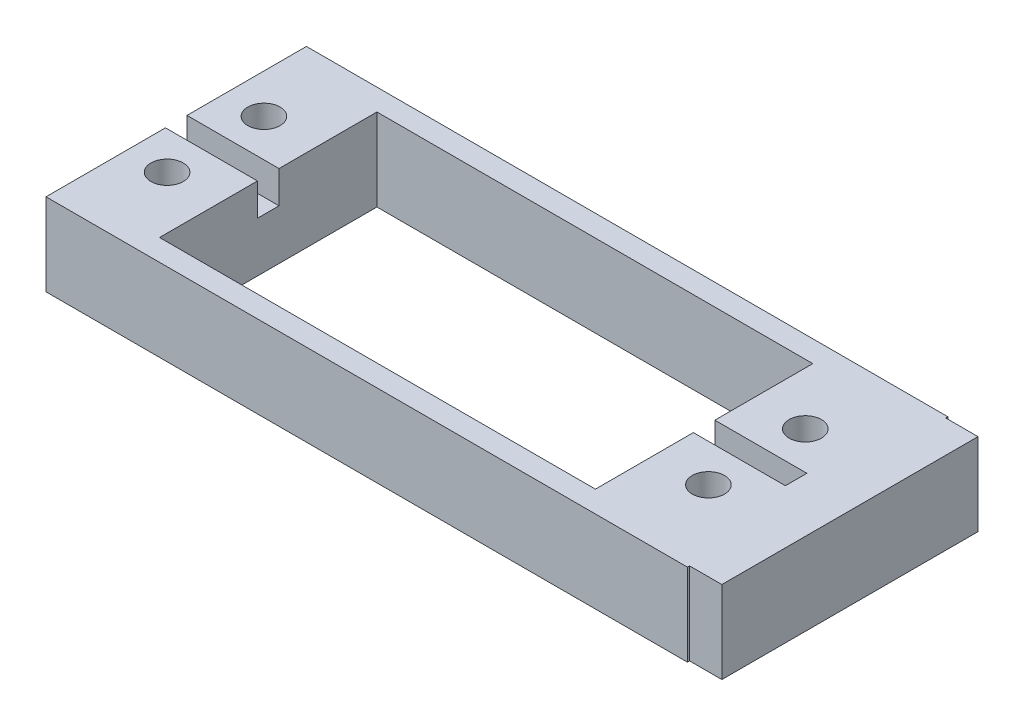
from build123d import *

# Parameters (mm, degrees)
SKETCH1_R             = 1.5
BOSS_EXTRUDE1_DEPTH   = 7.8
BOSS_EXTRUDE1_2_DEPTH = 7.8
SKETCH2_W             = 2
SKETCH2_H             = 20
BOSS_EXTRUDE2_DEPTH   = 7.8
SKETCH3_W             = 8.55
SKETCH3_H             = 0.1
BOSS_EXTRUDE3_DEPTH   = 7.8
SKETCH4_W             = 57.6
SKETCH4_H             = 2
BOSS_EXTRUDE4_DEPTH   = 7.8
SKETCH5_W             = 8.55
SKETCH5_H             = 2
CUT_EXTRUDE1_DEPTH    = 3
SKETCH6_R             = 1.5
BOSS_EXTRUDE5_DEPTH   = 7.8
SKETCH7_R             = 1.5
CUT_EXTRUDE2_DEPTH    = 4
SKETCH8_W             = 24.2
SKETCH8_H             = 7.8
BOSS_EXTRUDE6_DEPTH   = 5
SKETCH10_R            = 1.5
CUT_EXTRUDE3_DEPTH    = 110.980951326
SKETCH14_W            = 3
SKETCH14_H            = 0.2
CUT_EXTRUDE5_DEPTH    = 13.8
CUT_EXTRUDE6_DEPTH    = 0.15


with BuildPart() as part:
    # Sketch1 → Boss-Extrude1 (new body)
    with BuildSketch(Plane(origin=(0, 0, 0), x_dir=(1, 0, 0), z_dir=(0, 1, 0))):
        Polygon((-54.762761852, 25.466548835), (-54.762761852, 5.466548835), (-48.212761852, 5.466548835), (-48.212761852, 12.451776091), (-48.212761852, 18.48132158), (-48.212761852, 25.466548835), align=None)
        with Locations(Location((-49.862761852, 10.966548835, 0), (0, 0, 270))):
            Circle(SKETCH1_R, mode=Mode.SUBTRACT)
        with Locations(Location((-49.862761852, 19.966548835, 0), (0, 0, 270))):
            Circle(SKETCH1_R, mode=Mode.SUBTRACT)
    extrude(amount=BOSS_EXTRUDE1_DEPTH)



with BuildPart() as body_2:
    # Sketch1 → Boss-Extrude1 2 (new body)
    with BuildSketch(Plane(origin=(0, 0, 0), x_dir=(1, 0, 0), z_dir=(0, 1, 0))):
        Polygon((-101.812761852, 18.48132158), (-101.812761852, 12.451776091), (-101.812761852, 5.466548835), (-101.212761852, 5.466548835), (-95.262761852, 5.466548835), (-95.262761852, 25.466548835), (-101.812761852, 25.466548835), (-101.812761852, 24.866548835), (-101.812761852, 21.451776091), align=None)
        with Locations(Location((-100.162761852, 10.966548835, 0), (0, 0, 270))):
            Circle(SKETCH1_R, mode=Mode.SUBTRACT)
        with Locations(Location((-100.162761852, 19.966548835, 0), (0, 0, 270))):
            Circle(SKETCH1_R, mode=Mode.SUBTRACT)
    extrude(amount=BOSS_EXTRUDE1_2_DEPTH)


with BuildPart() as part_1:
    add(part.part)

    add(body_2.part)  # Boss-Extrude2 merges body 2
    # Sketch2 → Boss-Extrude2 (add)
    with BuildSketch(Plane(origin=(0, 7.8, 0), x_dir=(1, 0, 0), z_dir=(0, 1, 0))):
        with Locations((-47.212761852, 15.466548835)):
            Rectangle(SKETCH2_W, SKETCH2_H)
        with Locations((-102.812761852, 15.466548835)):
            Rectangle(SKETCH2_W, SKETCH2_H)
    extrude(amount=-BOSS_EXTRUDE2_DEPTH)

    # Sketch3 → Boss-Extrude3 (add)
    with BuildSketch(Plane(origin=(0, 7.8, 0), x_dir=(1, 0, 0), z_dir=(0, 1, 0))):
        with Locations((-99.537761852, 5.416548835)):
            Rectangle(SKETCH3_W, SKETCH3_H)
        with Locations((-99.537761852, 25.516548835)):
            Rectangle(SKETCH3_W, SKETCH3_H)
        with Locations((-50.487761852, 25.516548835)):
            Rectangle(SKETCH3_W, SKETCH3_H)
        with Locations((-50.487761852, 5.416548835)):
            Rectangle(SKETCH3_W, SKETCH3_H)
    extrude(amount=-BOSS_EXTRUDE3_DEPTH)

    # Sketch4 → Boss-Extrude4 (add)
    with BuildSketch(Plane(origin=(0, 7.8, 0), x_dir=(1, 0, 0), z_dir=(0, 1, 0))):
        with Locations((-75.012761852, 26.566548835)):
            Rectangle(SKETCH4_W, SKETCH4_H)
        with Locations((-75.012761852, 4.366548835)):
            Rectangle(SKETCH4_W, SKETCH4_H)
    extrude(amount=-BOSS_EXTRUDE4_DEPTH)

    # Sketch5 → Cut-Extrude1 (cut)
    with BuildSketch(Plane(origin=(0, 7.8, 0), x_dir=(1, 0, 0), z_dir=(0, 1, 0))):
        with Locations((-99.537761852, 15.466548835)):
            Rectangle(SKETCH5_W, SKETCH5_H)
        with Locations((-50.487761852, 15.466548835)):
            Rectangle(SKETCH5_W, SKETCH5_H)
    extrude(amount=-CUT_EXTRUDE1_DEPTH, mode=Mode.SUBTRACT)

    # Sketch6 → Boss-Extrude5 (add)
    # profile 1 of 10: a face of its own
    with BuildSketch(Plane(origin=(0, 7.8, 0), x_dir=(1, 0, 0), z_dir=(0, 1, 0))):
        with BuildLine():
            Line((-97.660965944, 3.366548835), (-97.660965944, -0.033392238))
            ThreePointArc((-97.660965944, -0.033392238), (-97.254605431, 1.835328112), (-96.108914501, 3.366548835))
            Line((-96.108914501, 3.366548835), (-97.660965944, 3.366548835))
        make_face()
    # profile 2 of 10: a face of its own
    with BuildSketch(Plane(origin=(0, 7.8, 0), x_dir=(1, 0, 0), z_dir=(0, 1, 0))):
        with BuildLine():
            ThreePointArc((-96.108914501, 3.366548835), (-97.254605431, 1.835328112), (-97.660965944, -0.033392238))
            ThreePointArc((-97.660965944, -0.033392238), (-96.342946459, -3.215372753), (-93.160965944, -4.533392238))
            ThreePointArc((-93.160965944, -4.533392238), (-89.978985428, -3.215372753), (-88.660965944, -0.033392238))
            ThreePointArc((-88.660965944, -0.033392238), (-89.067326456, 1.835328112), (-90.213017386, 3.366548835))
            Line((-90.213017386, 3.366548835), (-96.108914501, 3.366548835))
        make_face()
        with Locations(Location((-93.160965944, -0.033392238, 0), (0, 0, 270))):
            Circle(SKETCH6_R, mode=Mode.SUBTRACT)
    # profile 3 of 10: a face of its own
    with BuildSketch(Plane(origin=(0, 7.8, 0), x_dir=(1, 0, 0), z_dir=(0, 1, 0))):
        with BuildLine():
            ThreePointArc((-88.660965944, -0.033392238), (-89.978985428, -3.215372753), (-93.160965944, -4.533392238))
            Line((-93.160965944, -4.533392238), (-77.160965417, -4.533392238))
            ThreePointArc((-77.160965417, -4.533392238), (-81.376990489, -1.606647648), (-80.108913974, 3.366548835))
            Line((-80.108913974, 3.366548835), (-90.213017386, 3.366548835))
            ThreePointArc((-90.213017386, 3.366548835), (-89.067326456, 1.835328112), (-88.660965944, -0.033392238))
        make_face()
    # profile 4 of 10: a face of its own
    with BuildSketch(Plane(origin=(0, 7.8, 0), x_dir=(1, 0, 0), z_dir=(0, 1, 0))):
        with BuildLine():
            ThreePointArc((-80.108913974, 3.366548835), (-81.376990489, -1.606647648), (-77.160965417, -4.533392238))
            ThreePointArc((-77.160965417, -4.533392238), (-73.978984901, -3.215372753), (-72.660965417, -0.033392238))
            ThreePointArc((-72.660965417, -0.033392238), (-73.067325929, 1.835328112), (-74.213016859, 3.366548835))
            Line((-74.213016859, 3.366548835), (-80.108913974, 3.366548835))
        make_face()
        with Locations(Location((-77.160965417, -0.033392238, 0), (0, 0, 270))):
            Circle(SKETCH6_R, mode=Mode.SUBTRACT)
    # profile 5 of 10: a face of its own
    with BuildSketch(Plane(origin=(0, 7.8, 0), x_dir=(1, 0, 0), z_dir=(0, 1, 0))):
        with BuildLine():
            ThreePointArc((-74.213016859, 3.366548835), (-73.067325929, 1.835328112), (-72.660965417, -0.033392238))
            Line((-72.660965417, -0.033392238), (-72.660965417, 3.366548835))
            Line((-72.660965417, 3.366548835), (-74.213016859, 3.366548835))
        make_face()
    # profile 6 of 10: a face of its own
    with BuildSketch(Plane(origin=(0, 7.8, 0), x_dir=(1, 0, 0), z_dir=(0, 1, 0))):
        with BuildLine():
            ThreePointArc((-72.660965417, 30.966605859), (-73.978984901, 34.148586374), (-77.160965417, 35.466605859))
            ThreePointArc((-77.160965417, 35.466605859), (-81.377021429, 32.539778353), (-80.108780241, 27.566548835))
            Line((-80.108780241, 27.566548835), (-74.213150592, 27.566548835))
            ThreePointArc((-74.213150592, 27.566548835), (-73.067362681, 29.097805001), (-72.660965417, 30.966605859))
        make_face()
        with Locations(Location((-77.160965417, 30.966605859, 0), (0, 0, 270))):
            Circle(SKETCH6_R, mode=Mode.SUBTRACT)
    # profile 7 of 10: a face of its own
    with BuildSketch(Plane(origin=(0, 7.8, 0), x_dir=(1, 0, 0), z_dir=(0, 1, 0))):
        with BuildLine():
            Line((-74.213150592, 27.566548835), (-72.660965417, 27.566548835))
            Line((-72.660965417, 27.566548835), (-72.660965417, 30.966605859))
            ThreePointArc((-72.660965417, 30.966605859), (-73.067362681, 29.097805001), (-74.213150592, 27.566548835))
        make_face()
    # profile 8 of 10: a face of its own
    with BuildSketch(Plane(origin=(0, 7.8, 0), x_dir=(1, 0, 0), z_dir=(0, 1, 0))):
        with BuildLine():
            Line((-77.160965417, 35.466605859), (-93.160965944, 35.466605859))
            ThreePointArc((-93.160965944, 35.466605859), (-89.978985428, 34.148586374), (-88.660965944, 30.966605859))
            ThreePointArc((-88.660965944, 30.966605859), (-89.067363208, 29.097805001), (-90.213151119, 27.566548835))
            Line((-90.213151119, 27.566548835), (-80.108780241, 27.566548835))
            ThreePointArc((-80.108780241, 27.566548835), (-81.377021429, 32.539778353), (-77.160965417, 35.466605859))
        make_face()
    # profile 9 of 10: a face of its own
    with BuildSketch(Plane(origin=(0, 7.8, 0), x_dir=(1, 0, 0), z_dir=(0, 1, 0))):
        with BuildLine():
            ThreePointArc((-93.160965944, 35.466605859), (-96.342946459, 34.148586374), (-97.660965944, 30.966605859))
            ThreePointArc((-97.660965944, 30.966605859), (-97.254568679, 29.097805001), (-96.108780768, 27.566548835))
            Line((-96.108780768, 27.566548835), (-90.213151119, 27.566548835))
            ThreePointArc((-90.213151119, 27.566548835), (-89.067363208, 29.097805001), (-88.660965944, 30.966605859))
            ThreePointArc((-88.660965944, 30.966605859), (-89.978985428, 34.148586374), (-93.160965944, 35.466605859))
        make_face()
        with Locations(Location((-93.160965944, 30.966605859, 0), (0, 0, 270))):
            Circle(SKETCH6_R, mode=Mode.SUBTRACT)
    # profile 10 of 10: a face of its own
    with BuildSketch(Plane(origin=(0, 7.8, 0), x_dir=(1, 0, 0), z_dir=(0, 1, 0))):
        with BuildLine():
            Line((-97.660965944, 30.966605859), (-97.660965944, 27.566548835))
            Line((-97.660965944, 27.566548835), (-96.108780768, 27.566548835))
            ThreePointArc((-96.108780768, 27.566548835), (-97.254568679, 29.097805001), (-97.660965944, 30.966605859))
        make_face()
    extrude(amount=-BOSS_EXTRUDE5_DEPTH)

    # Sketch7 → Cut-Extrude2 (cut)
    # profile 1 of 2: a face of its own
    with BuildSketch(Plane(origin=(0, 7.8, 0), x_dir=(1, 0, 0), z_dir=(0, 1, 0))):
        with BuildLine():
            Line((-97.660965944, 3.366548835), (-72.660965417, 3.366548835))
            Line((-72.660965417, 3.366548835), (-72.660965417, -0.033392238))
            ThreePointArc((-72.660965417, -0.033392238), (-73.978984901, -3.215372753), (-77.160965417, -4.533392238))
            Line((-77.160965417, -4.533392238), (-93.160965944, -4.533392238))
            ThreePointArc((-93.160965944, -4.533392238), (-96.342946459, -3.215372753), (-97.660965944, -0.033392238))
            Line((-97.660965944, -0.033392238), (-97.660965944, 3.366548835))
        make_face()
        with Locations(Location((-77.160965417, -0.033392238, 0), (0, 0, 270))):
            Circle(SKETCH7_R, mode=Mode.SUBTRACT)
        with Locations(Location((-93.160965944, -0.033392238, 0), (0, 0, 270))):
            Circle(SKETCH7_R, mode=Mode.SUBTRACT)
    # profile 2 of 2: a face of its own
    with BuildSketch(Plane(origin=(0, 7.8, 0), x_dir=(1, 0, 0), z_dir=(0, 1, 0))):
        with BuildLine():
            Line((-77.160965417, 35.466605859), (-93.160965944, 35.466605859))
            ThreePointArc((-93.160965944, 35.466605859), (-96.342946459, 34.148586374), (-97.660965944, 30.966605859))
            Line((-97.660965944, 30.966605859), (-97.660965944, 27.566548835))
            Line((-97.660965944, 27.566548835), (-72.660965417, 27.566548835))
            Line((-72.660965417, 27.566548835), (-72.660965417, 30.966605859))
            ThreePointArc((-72.660965417, 30.966605859), (-73.978984901, 34.148586374), (-77.160965417, 35.466605859))
        make_face()
    extrude(amount=-CUT_EXTRUDE2_DEPTH, mode=Mode.SUBTRACT)

    # Sketch8 → Boss-Extrude6 (add)
    with BuildSketch(Plane(origin=(-46.212761852, 0, 0), x_dir=(0, 0, -1), z_dir=(1, 0, 0))):
        with Locations((15.466548835, 3.9)):
            Rectangle(SKETCH8_W, SKETCH8_H)
    extrude(amount=BOSS_EXTRUDE6_DEPTH)

    # Sketch10 → Cut-Extrude3 (cut, through all)
    # profile 1 of 2: a face of its own
    with BuildSketch(Plane.XZ):
        with BuildLine():
            Line((-97.660965944, 0.033392238), (-97.660965944, -3.366548835))
            Line((-97.660965944, -3.366548835), (-72.660965417, -3.366548835))
            Line((-72.660965417, -3.366548835), (-72.660965417, 0.033392238))
            ThreePointArc((-72.660965417, 0.033392238), (-73.978984901, 3.215372753), (-77.160965417, 4.533392238))
            Line((-77.160965417, 4.533392238), (-93.160965944, 4.533392238))
            ThreePointArc((-93.160965944, 4.533392238), (-96.342946459, 3.215372753), (-97.660965944, 0.033392238))
        make_face()
        with Locations((-93.160965944, 0.033392238)):
            Circle(SKETCH10_R, mode=Mode.SUBTRACT)
        with Locations((-77.160965417, 0.033392238)):
            Circle(SKETCH10_R, mode=Mode.SUBTRACT)
    # profile 2 of 2: a face of its own
    with BuildSketch(Plane.XZ):
        with BuildLine():
            Line((-72.660965417, -27.566548835), (-97.660965944, -27.566548835))
            Line((-97.660965944, -27.566548835), (-97.660965944, -30.966605859))
            ThreePointArc((-97.660965944, -30.966605859), (-96.342946459, -34.148586374), (-93.160965944, -35.466605859))
            Line((-93.160965944, -35.466605859), (-77.160965417, -35.466605859))
            ThreePointArc((-77.160965417, -35.466605859), (-73.978984901, -34.148586374), (-72.660965417, -30.966605859))
            Line((-72.660965417, -30.966605859), (-72.660965417, -27.566548835))
        make_face()
        with Locations((-93.160965944, -30.966605859)):
            Circle(SKETCH10_R, mode=Mode.SUBTRACT)
        with Locations((-77.160965417, -30.966605859)):
            Circle(SKETCH10_R, mode=Mode.SUBTRACT)
    extrude(amount=-CUT_EXTRUDE3_DEPTH, mode=Mode.SUBTRACT)

    # Sketch14 → Cut-Extrude5 (cut)
    with BuildSketch(Plane.XZ):
        with Locations((-42.712761852, -3.466548835)):
            Rectangle(SKETCH14_W, SKETCH14_H)
        with Locations((-42.712761852, -27.466548835)):
            Rectangle(SKETCH14_W, SKETCH14_H)
    extrude(amount=-CUT_EXTRUDE5_DEPTH, mode=Mode.SUBTRACT)

    # Sketch15 → Cut-Extrude6 (cut)
    with BuildSketch(Plane.XZ):
        Polygon((-41.212761852, -3.566548835), (-44.212761852, -3.566548835), (-44.212761852, -3.366548835), (-103.812761852, -3.366548835), (-103.812761852, -27.566548835), (-44.212761852, -27.566548835), (-44.212761852, -27.366548835), (-41.212761852, -27.366548835), align=None)
    extrude(amount=-CUT_EXTRUDE6_DEPTH, mode=Mode.SUBTRACT)


solid = part_1.part
